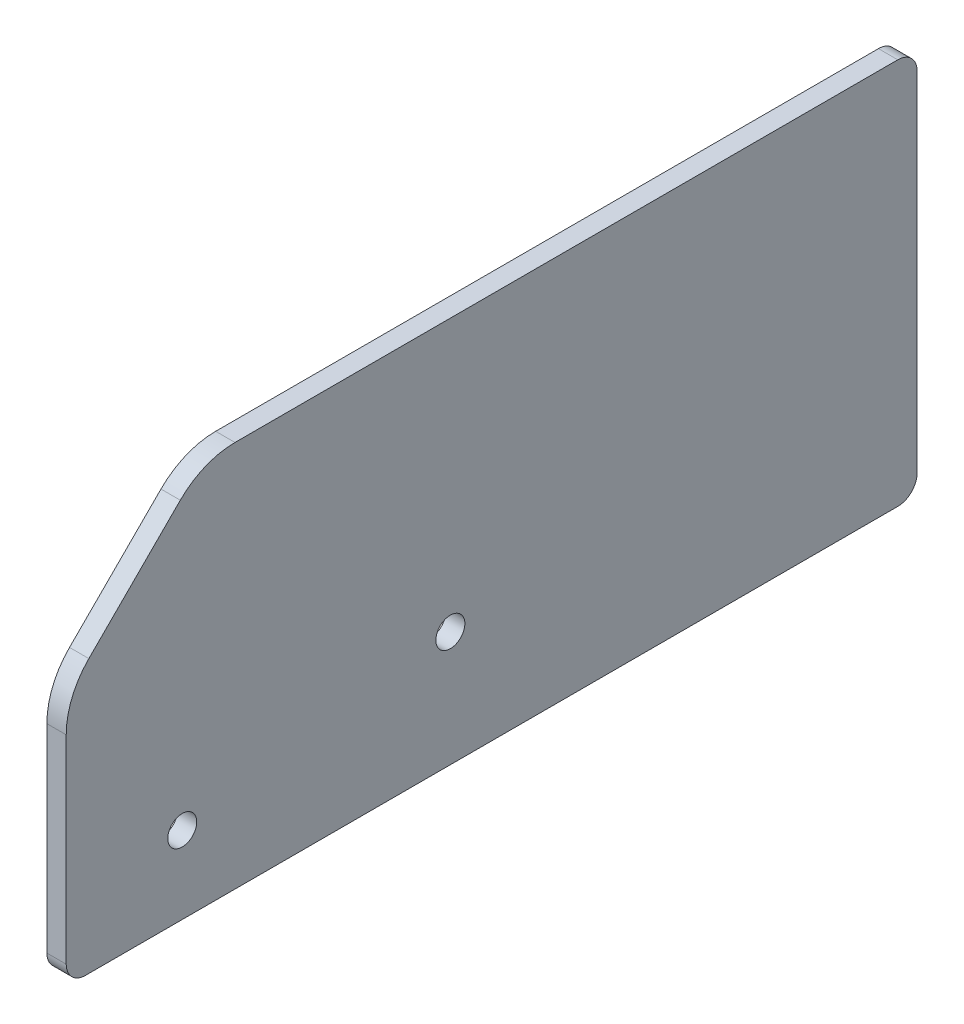
from build123d import *

# Parameters (mm, degrees)
SKETCH1_R           = 4.7625
BOSS_EXTRUDE1_DEPTH = 6.35


with BuildPart() as part:
    # Sketch1 → Boss-Extrude1 (new body)
    with BuildSketch(Plane(origin=(0, 0, 0), x_dir=(0, 0, -1), z_dir=(1, 0, 0))):
        with BuildLine():
            Line((6.35, 0), (273.05, 0))
            ThreePointArc((273.05, 0), (277.540128061, 1.859871939), (279.4, 6.35))
            Line((279.4, 6.35), (279.4, 120.65))
            ThreePointArc((279.4, 120.65), (277.540128061, 125.140128061), (273.05, 127))
            Line((273.05, 127), (55.42230509, 127))
            ThreePointArc((55.42230509, 127), (45.702145908, 125.066540126), (37.461792847, 119.560512242))
            Line((37.461792847, 119.560512242), (7.439487758, 89.538207153))
            ThreePointArc((7.439487758, 89.538207153), (1.933459874, 81.297854092), (0, 71.57769491))
            Line((0, 71.57769491), (0, 6.35))
            ThreePointArc((0, 6.35), (1.859871939, 1.859871939), (6.35, 0))
        make_face()
        with Locations((38.1, 25.4)):
            Circle(SKETCH1_R, mode=Mode.SUBTRACT)
        with Locations((126.134831311, 37.772488675)):
            Circle(SKETCH1_R, mode=Mode.SUBTRACT)
    extrude(amount=BOSS_EXTRUDE1_DEPTH)


solid = part.part
